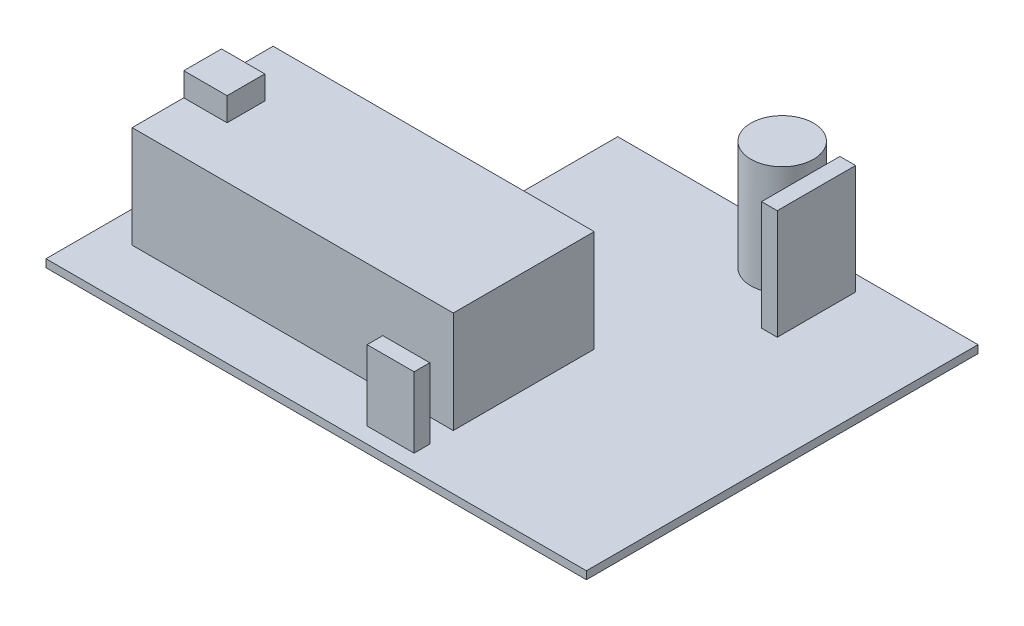
from build123d import *

# Parameters (mm, degrees)
BOSS_EXTRUDE1_DEPTH = 1
SKETCH3_W           = 41
SKETCH3_H           = 18
BOSS_EXTRUDE2_DEPTH = 13
SKETCH4_W           = 5.527991342
SKETCH4_H           = 4.817179588
BOSS_EXTRUDE3_DEPTH = 3
SKETCH5_W           = 6
SKETCH5_H           = 2
BOSS_EXTRUDE4_DEPTH = 9
SKETCH6_R           = 4
BOSS_EXTRUDE5_DEPTH = 14
SKETCH7_W           = 2
SKETCH7_H           = 10
BOSS_EXTRUDE6_DEPTH = 14


with BuildPart() as part:
    # Sketch2 → Boss-Extrude1 (new body)
    with BuildSketch(Plane(origin=(0, 0, 0), x_dir=(1, 0, 0), z_dir=(0, 1, 0))):
        Polygon((0, 32), (0, 0), (69, 0), (69, 50), (23, 50), (23, 32), align=None)
    extrude(amount=BOSS_EXTRUDE1_DEPTH)

    # Sketch3 → Boss-Extrude2 (add)
    with BuildSketch(Plane(origin=(0, 1, 0), x_dir=(1, 0, 0), z_dir=(0, 1, 0))):
        with Locations((24.5, 16)):
            Rectangle(SKETCH3_W, SKETCH3_H)
    extrude(amount=BOSS_EXTRUDE2_DEPTH)

    # Sketch4 → Boss-Extrude3 (add)
    with BuildSketch(Plane(origin=(0, 14, 0), x_dir=(1, 0, 0), z_dir=(0, 1, 0))):
        with Locations((6.763995671, 16)):
            Rectangle(SKETCH4_W, SKETCH4_H)
    extrude(amount=BOSS_EXTRUDE3_DEPTH)

    # Sketch5 → Boss-Extrude4 (add)
    with BuildSketch(Plane(origin=(0, 1, 0), x_dir=(1, 0, 0), z_dir=(0, 1, 0))):
        with Locations((42, 3)):
            Rectangle(SKETCH5_W, SKETCH5_H)
    extrude(amount=BOSS_EXTRUDE4_DEPTH)

    # Sketch6 → Boss-Extrude5 (add)
    with BuildSketch(Plane(origin=(0, 1, 0), x_dir=(1, 0, 0), z_dir=(0, 1, 0))):
        with Locations(Location((48, 46, 0), (0, 0, 90))):
            Circle(SKETCH6_R)
    extrude(amount=BOSS_EXTRUDE5_DEPTH)

    # Sketch7 → Boss-Extrude6 (add)
    with BuildSketch(Plane(origin=(0, 1, 0), x_dir=(1, 0, 0), z_dir=(0, 1, 0))):
        with Locations((54.368547089, 43)):
            Rectangle(SKETCH7_W, SKETCH7_H)
    extrude(amount=BOSS_EXTRUDE6_DEPTH)


solid = part.part
